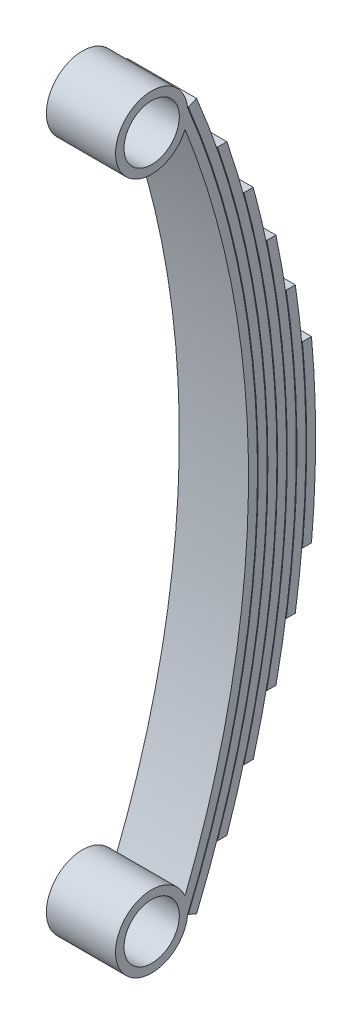
from build123d import *

# Parameters (mm, degrees)
SKETCH1_R           = 40
BOSS_EXTRUDE1_DEPTH = 50
BOSS_EXTRUDE2_DEPTH = 100
BOSS_EXTRUDE3_DEPTH = 100
BOSS_EXTRUDE4_DEPTH = 100
BOSS_EXTRUDE5_DEPTH = 100
BOSS_EXTRUDE6_DEPTH = 100
BOSS_EXTRUDE7_DEPTH = 100


with BuildPart() as part:
    # Sketch1 → Boss-Extrude1 (new, symmetric)
    with BuildSketch(Plane.YZ):
        with BuildLine():
            ThreePointArc((-479.851684164, 91.802019036), (-507.809078393, 191.652863373), (-505, 88))
            ThreePointArc((-505, 88), (0, -13), (505, 88))
            ThreePointArc((505, 88), (507.809078393, 191.652863373), (479.851684164, 91.802019036))
            ThreePointArc((479.851684164, 91.802019036), (0, 0), (-479.851684164, 91.802019036))
        make_face()
        with Locations(Location((-500, 140, 0), (0, 0, 270))):
            Circle(SKETCH1_R, mode=Mode.SUBTRACT)
        with Locations(Location((500, 140, 0), (0, 0, 270))):
            Circle(SKETCH1_R, mode=Mode.SUBTRACT)
    extrude(amount=BOSS_EXTRUDE1_DEPTH, both=True)


with BuildPart() as body_2:
    # Sketch2 → Boss-Extrude2 (new body)
    with BuildSketch(Plane.YZ.offset(50)):
        with BuildLine():
            Line((-505.384615385, 87.076923077), (-510.384615385, 75.076923077))
            ThreePointArc((-510.384615385, 75.076923077), (0, -27), (510.384615385, 75.076923077))
            Line((510.384615385, 75.076923077), (505.384615385, 87.076923077))
            ThreePointArc((505.384615385, 87.076923077), (0, -14), (-505.384615385, 87.076923077))
        make_face()
    extrude(amount=-BOSS_EXTRUDE2_DEPTH)


with BuildPart() as body_3:
    # Sketch3 → Boss-Extrude3 (new body)
    with BuildSketch(Plane.YZ.offset(50)):
        with BuildLine():
            Line((434.269230769, 45.012256949), (434.269230769, 31.263922162))
            ThreePointArc((434.269230769, 31.263922162), (0, -41), (-434.269230769, 31.263922162))
            Line((-434.269230769, 31.263922162), (-434.269230769, 45.012256949))
            ThreePointArc((-434.269230769, 45.012256949), (0, -28), (434.269230769, 45.012256949))
        make_face()
    extrude(amount=-BOSS_EXTRUDE3_DEPTH)


with BuildPart() as body_4:
    # Sketch4 → Boss-Extrude4 (new body)
    with BuildSketch(Plane.YZ.offset(50)):
        with BuildLine():
            Line((-358.093070613, -6.826060644), (-358.093070613, 6.658068112))
            ThreePointArc((-358.093070613, 6.658068112), (0, -42), (358.093070613, 6.658068112))
            Line((358.093070613, 6.658068112), (358.093070613, -6.826060644))
            ThreePointArc((358.093070613, -6.826060644), (0, -55), (-358.093070613, -6.826060644))
        make_face()
    extrude(amount=-BOSS_EXTRUDE4_DEPTH)


with BuildPart() as body_5:
    # Sketch5 → Boss-Extrude5 (new body)
    with BuildSketch(Plane.YZ.offset(50)):
        with BuildLine():
            Line((-281.857345942, -39.6706448), (-281.857345942, -26.383216321))
            ThreePointArc((-281.857345942, -26.383216321), (0, -56), (281.857345942, -26.383216321))
            Line((281.857345942, -26.383216321), (281.857345942, -39.6706448))
            ThreePointArc((281.857345942, -39.6706448), (0, -69), (-281.857345942, -39.6706448))
        make_face()
    extrude(amount=-BOSS_EXTRUDE5_DEPTH)


with BuildPart() as body_6:
    # Sketch6 → Boss-Extrude6 (new body)
    with BuildSketch(Plane.YZ.offset(50)):
        with BuildLine():
            Line((-205.563231513, -54.490220655), (-205.563231513, -67.637655905))
            ThreePointArc((-205.563231513, -67.637655905), (0, -83), (205.563231513, -67.637655905))
            Line((205.563231513, -67.637655905), (205.563231513, -54.490220655))
            ThreePointArc((205.563231513, -54.490220655), (0, -70), (-205.563231513, -54.490220655))
        make_face()
    extrude(amount=-BOSS_EXTRUDE6_DEPTH)


with BuildPart() as body_7:
    # Sketch7 → Boss-Extrude7 (new body)
    with BuildSketch(Plane.YZ.offset(50)):
        with BuildLine():
            Line((-129.211867255, -77.95511297), (-129.211867255, -91.011607917))
            ThreePointArc((-129.211867255, -91.011607917), (0, -97), (129.211867255, -91.011607917))
            Line((129.211867255, -91.011607917), (129.211867255, -77.95511297))
            ThreePointArc((129.211867255, -77.95511297), (0, -84), (-129.211867255, -77.95511297))
        make_face()
    extrude(amount=-BOSS_EXTRUDE7_DEPTH)


solid = Compound([part.part, body_2.part, body_3.part, body_4.part, body_5.part, body_6.part, body_7.part])
